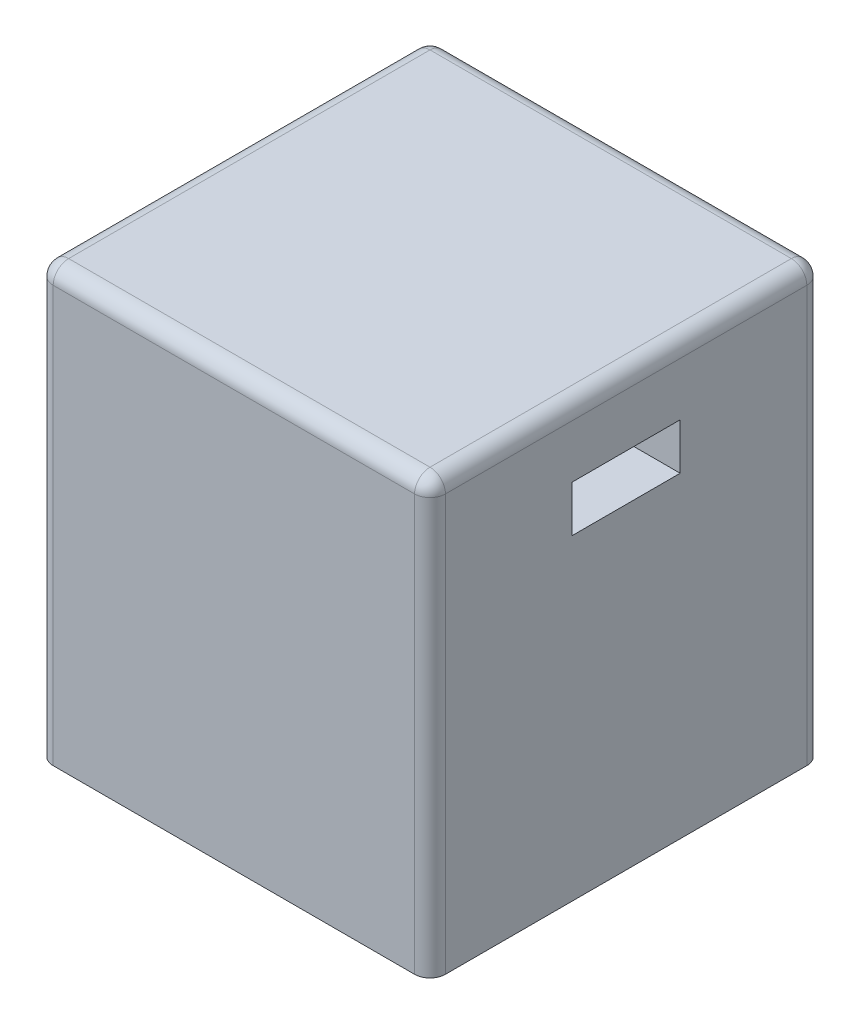
from build123d import *

# Parameters (mm, degrees)
SKETCH1_W           = 25.4
SKETCH1_H           = 25.4
BOSS_EXTRUDE1_DEPTH = 13.97
SKETCH2_R           = 1.5
CUT_EXTRUDE1_DEPTH  = 5.08
SKETCH3_W           = 7
SKETCH3_H           = 3
CUT_EXTRUDE2_DEPTH  = 32.648236918
FILLET1_R           = 1


with BuildPart() as part:
    # Sketch1 → Boss-Extrude1 (new, symmetric)
    with BuildSketch(Plane(origin=(0, 0, 0), x_dir=(1, 0, 0), z_dir=(0, 1, 0))):
        Rectangle(SKETCH1_W, SKETCH1_H)
    extrude(amount=BOSS_EXTRUDE1_DEPTH, both=True)

    # Sketch2 → Cut-Extrude1 (cut)
    with BuildSketch(Plane.XZ.offset(13.97)):
        with Locations(Location((-6.35, 6.35, 0), (0, 0, 270))):
            Circle(SKETCH2_R)
        with Locations(Location((6.35, 6.35, 0), (0, 0, 270))):
            Circle(SKETCH2_R)
        with Locations(Location((6.35, -6.35, 0), (0, 0, 270))):
            Circle(SKETCH2_R)
        with Locations(Location((-6.35, -6.35, 0), (0, 0, 270))):
            Circle(SKETCH2_R)
    extrude(amount=-CUT_EXTRUDE1_DEPTH, mode=Mode.SUBTRACT)

    # Sketch3 → Cut-Extrude2 (cut, through all)
    with BuildSketch(Plane(origin=(12.7, 0, 0), x_dir=(0, 0, -1), z_dir=(1, 0, 0))):
        with Locations((0, 8.03)):
            Rectangle(SKETCH3_W, SKETCH3_H)
    extrude(amount=-CUT_EXTRUDE2_DEPTH, mode=Mode.SUBTRACT)

    # Fillet1
    fillet1_edges = [part.edges().sort_by_distance(p)[0] for p in [
        (-12.7, 13.97, 0),
        (0, 13.97, 12.7),
        (12.7, 13.97, 0),
        (12.7, 0, 12.7),
        (-12.7, 0, 12.7),
        (-12.7, 0, -12.7),
        (12.7, 0, -12.7),
        (0, 13.97, -12.7),
    ]]
    fillet(fillet1_edges, radius=FILLET1_R)


solid = part.part
